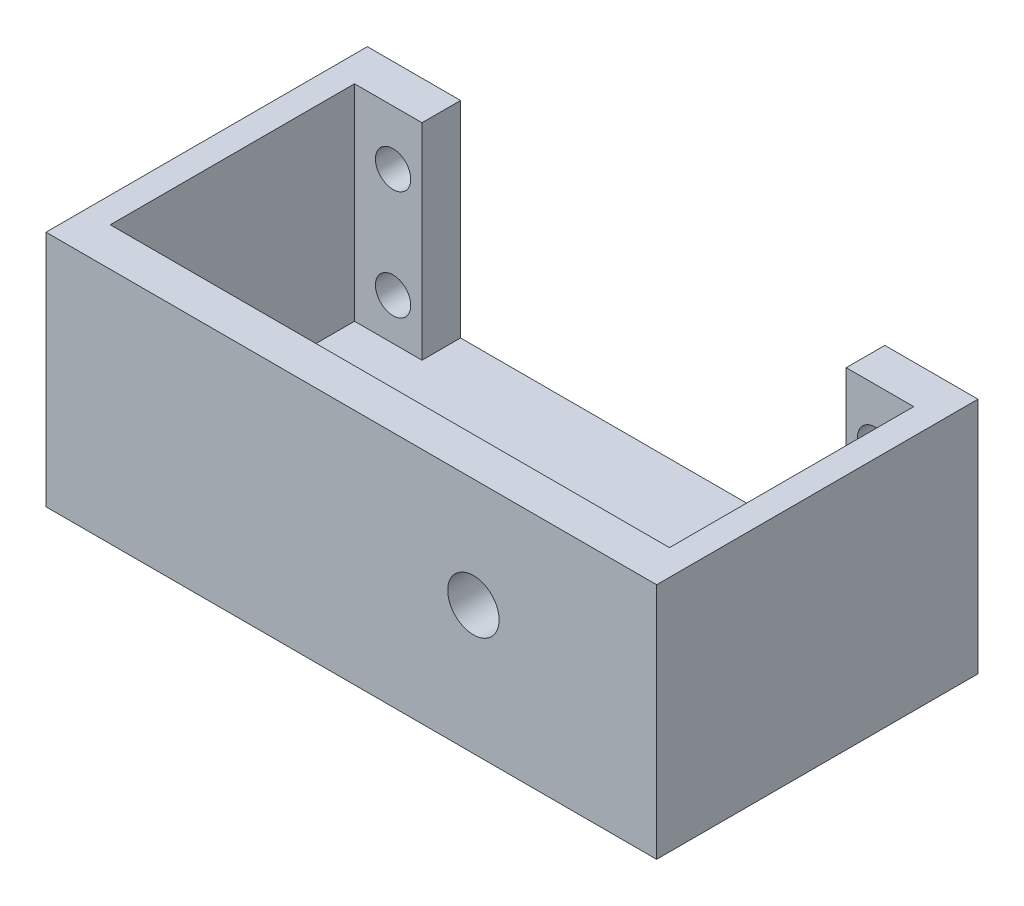
from build123d import *

# Parameters (mm, degrees)
SKETCH1_W           = 95
SKETCH1_H           = 50
BOSS_EXTRUDE1_DEPTH = 5
SKETCH2_W           = 14.5
SKETCH2_H           = 6
BOSS_EXTRUDE2_DEPTH = 32
SKETCH4_R           = 2.75
CUT_EXTRUDE1_DEPTH  = 6
SKETCH6_R           = 2.7
CUT_EXTRUDE2_DEPTH  = 6
BOSS_EXTRUDE5_DEPTH = 32
SKETCH11_R          = 4
CUT_EXTRUDE3_DEPTH  = 6


with BuildPart() as part:
    # Sketch1 → Boss-Extrude1 (new body)
    with BuildSketch(Plane(origin=(0, 0, 0), x_dir=(1, 0, 0), z_dir=(0, 1, 0))):
        Rectangle(SKETCH1_W, SKETCH1_H)
    extrude(amount=BOSS_EXTRUDE1_DEPTH)

    # Sketch2 → Boss-Extrude2 (add)
    with BuildSketch(Plane(origin=(0, 5, 0), x_dir=(1, 0, 0), z_dir=(0, 1, 0))):
        with Locations((-40.25, 22)):
            Rectangle(SKETCH2_W, SKETCH2_H)
        with Locations((40.25, 22)):
            Rectangle(SKETCH2_W, SKETCH2_H)
    extrude(amount=BOSS_EXTRUDE2_DEPTH)

    # Sketch4 → Cut-Extrude1 (cut)
    with BuildSketch(Plane(origin=(0, 0, -25), x_dir=(-1, 0, 0), z_dir=(0, 0, -1))):
        with Locations((37.5, 11.5)):
            Circle(SKETCH4_R)
        with Locations((37.5, 28.5)):
            Circle(SKETCH4_R)
        with Locations(Location((-37.5, 28.5, 0), (0, 0, 180))):
            Circle(SKETCH4_R)
        with Locations(Location((-37.5, 11.5, 0), (0, 0, 180))):
            Circle(SKETCH4_R)
    extrude(amount=-CUT_EXTRUDE1_DEPTH, mode=Mode.SUBTRACT)

    # Sketch6 → Cut-Extrude2 (cut)
    with BuildSketch(Plane(origin=(0, 5, 0), x_dir=(1, 0, 0), z_dir=(0, 1, 0))):
        with Locations(Location((-38, 0, 0), (0, 0, 270))):
            Circle(SKETCH6_R)
        with Locations(Location((38, 0, 0), (0, 0, 270))):
            Circle(SKETCH6_R)
    extrude(amount=-CUT_EXTRUDE2_DEPTH, mode=Mode.SUBTRACT)

    # Sketch10 → Boss-Extrude5 (add)
    with BuildSketch(Plane(origin=(0, 5, 0), x_dir=(1, 0, 0), z_dir=(0, 1, 0))):
        Polygon((-47.5, -14), (-47.5, -25), (-43.5, -25), (43.5, -25), (47.5, -25), (47.5, -19), (47.5, 19), (43.5, 19), (43.5, -19), (-43.5, -19), (-43.5, 19), (-47.5, 19), align=None)
    extrude(amount=BOSS_EXTRUDE5_DEPTH)

    # Sketch11 → Cut-Extrude3 (cut)
    with BuildSketch(Plane.XY.offset(25)):
        with Locations((19, 20)):
            Circle(SKETCH11_R)
    extrude(amount=-CUT_EXTRUDE3_DEPTH, mode=Mode.SUBTRACT)


solid = part.part
